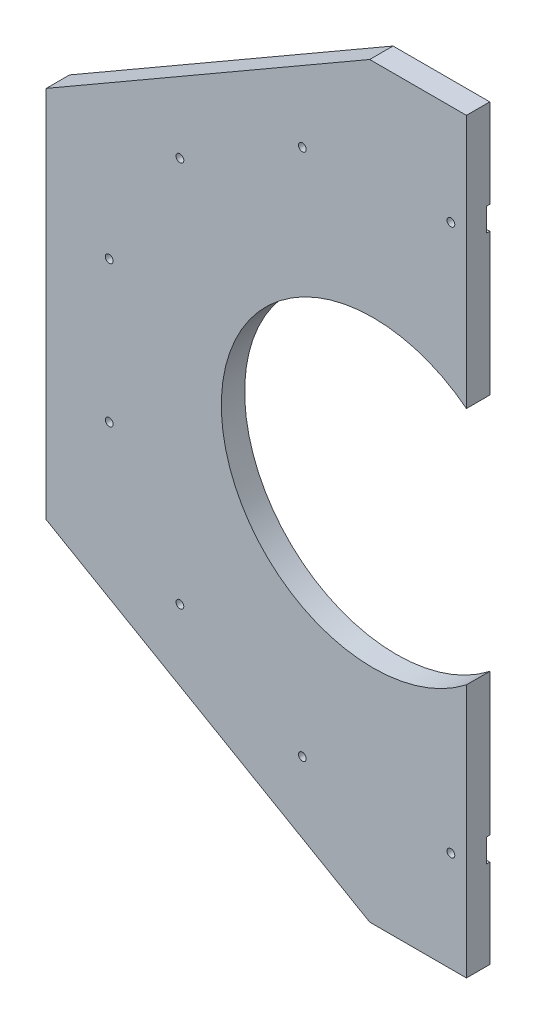
from build123d import *

# Parameters (mm, degrees)
EXTRUDE_1_DEPTH          = 15
CUT_EXTRUDE_2_DEPTH      = 2
SKETCH_2_R               = 97.5
CUT_EXTRUDE_3_DEPTH      = 279.25348156
CUT_EXTRUDE_4_DEPTH      = 279.25348156
CUT_EXTRUDE_4_DEPTH_BACK = 279.25348156
HOLE_WIZARD_M6_1_D       = 5


with BuildPart() as part:
    # 草图1 → 凸台-拉伸1 (new body)
    with BuildSketch(Plane.XY):
        with BuildLine():
            Line((140, 183), (140, 240))
            Line((140, 240), (-140, 240))
            Line((-140, 240), (-140, -240))
            Line((-140, -240), (140, -240))
            Line((140, -240), (140, -183))
            Line((140, -183), (80, -183))
            ThreePointArc((80, -183), (-103, 0), (80, 183))
            Line((80, 183), (140, 183))
        make_face()
        with BuildLine():
            Line((140, -168), (140, 168))
            Line((140, 168), (80, 168))
            ThreePointArc((80, 168), (-88, 0), (80, -168))
            Line((80, -168), (140, -168))
        make_face()
        with BuildLine():
            Line((140, 168), (140, 183))
            Line((140, 183), (80, 183))
            ThreePointArc((80, 183), (-103, 0), (80, -183))
            Line((80, -183), (140, -183))
            Line((140, -183), (140, -168))
            Line((140, -168), (80, -168))
            ThreePointArc((80, -168), (-88, 0), (80, 168))
            Line((80, 168), (140, 168))
        make_face()
    extrude(amount=EXTRUDE_1_DEPTH)

    # 草图1<4> → 切除-拉伸2 (cut)
    with BuildSketch(Plane.XY):
        with BuildLine():
            Line((140, 168), (140, 183))
            Line((140, 183), (80, 183))
            ThreePointArc((80, 183), (-103, 0), (80, -183))
            Line((80, -183), (140, -183))
            Line((140, -183), (140, -168))
            Line((140, -168), (80, -168))
            ThreePointArc((80, -168), (-88, 0), (80, 168))
            Line((80, 168), (140, 168))
        make_face()
    extrude(amount=CUT_EXTRUDE_2_DEPTH, mode=Mode.SUBTRACT)

    # 草图2 → 切除-拉伸3 (cut, through all)
    with BuildSketch(Plane(origin=(0, 0, 0), x_dir=(-1, 0, 0), z_dir=(0, 0, -1))):
        with Locations((-80, 0)):
            Circle(SKETCH_2_R)
    extrude(amount=-CUT_EXTRUDE_3_DEPTH, mode=Mode.SUBTRACT)

    # 草图3 → 切除-拉伸4 (cut, two sides: drawn at the far end of the back side and taken through both)
    with BuildSketch(Plane(origin=(0, 0, 0), x_dir=(-1, 0, 0), z_dir=(0, 0, -1)).offset(-CUT_EXTRUDE_4_DEPTH_BACK)):
        Polygon((140, 240), (-77.846096908, 240), (130, 120), (130, -120), (-77.846096908, -240), (140, -240), align=None)
    extrude(amount=CUT_EXTRUDE_4_DEPTH + CUT_EXTRUDE_4_DEPTH_BACK, mode=Mode.SUBTRACT)

    # M6 螺纹孔1 (through all)
    with Locations(Plane(origin=(0, 0, 2), x_dir=(-1, 0, 0), z_dir=(0, 0, -1))):
        with Locations((-34.577257585, -169.519982514), (44.097240098, -124.097240098), (89.519982514, -45.422742415), (89.519982514, 45.422742415), (44.097240098, 124.097240098), (-34.577257585, 169.519982514), (-130, 175.5), (-130, -175.5)):
            Hole(HOLE_WIZARD_M6_1_D / 2)


solid = part.part
